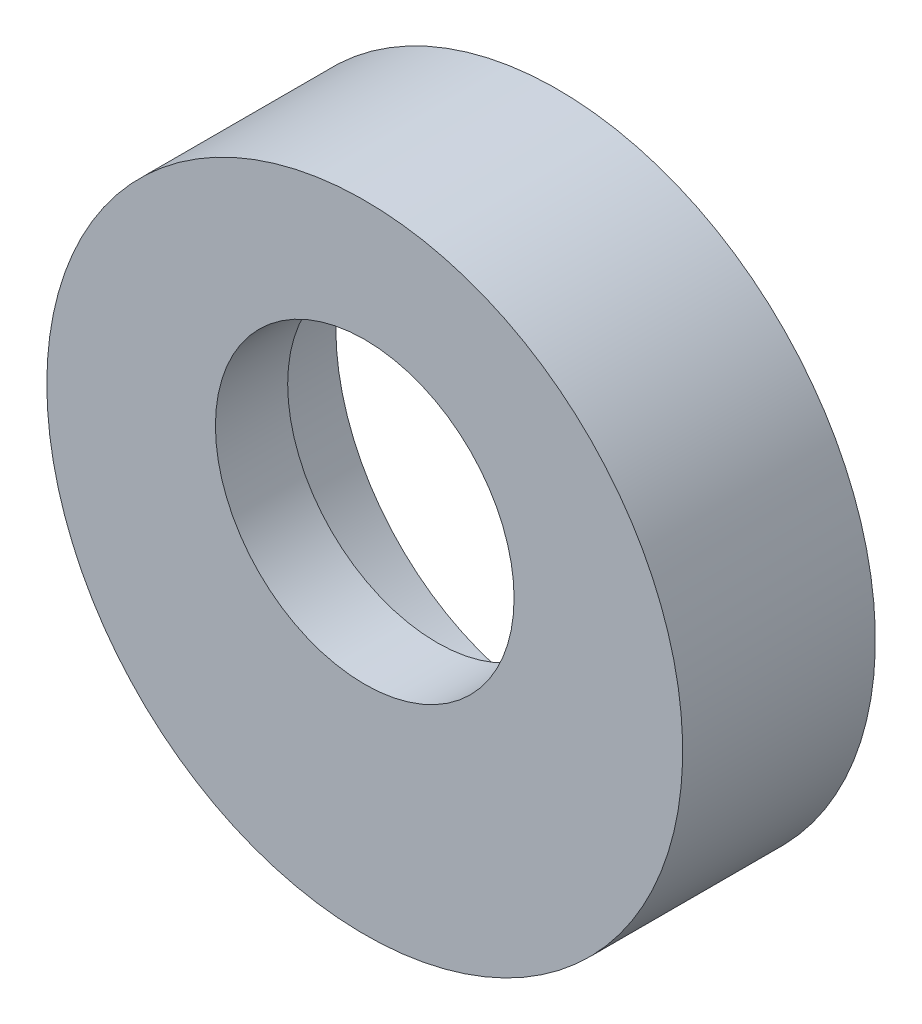
from build123d import *

# Parameters (mm, degrees)
SKETCH3_R          = 3.1
CUT_EXTRUDE1_DEPTH = 11.15480182


with BuildPart() as part:
    # Sketch2 → Revolve1 (revolve)
    with BuildSketch(Plane(origin=(0, 0, 0), x_dir=(1, 0, 0), z_dir=(0, 1, 0))):
        Polygon((-6.6, 4), (-6.6, 0), (0, 0), (0, 1.5), (-4.6, 1.5), (-4.6, 4), align=None)
    revolve(axis=Axis((0, 0, -55.960235465), (0, 0, 1)))

    # Sketch3 → Cut-Extrude1 (cut, through all)
    with BuildSketch(Plane.XY):
        with Locations((0, 1)):
            Circle(SKETCH3_R)
    extrude(amount=-CUT_EXTRUDE1_DEPTH, mode=Mode.SUBTRACT)


solid = part.part
